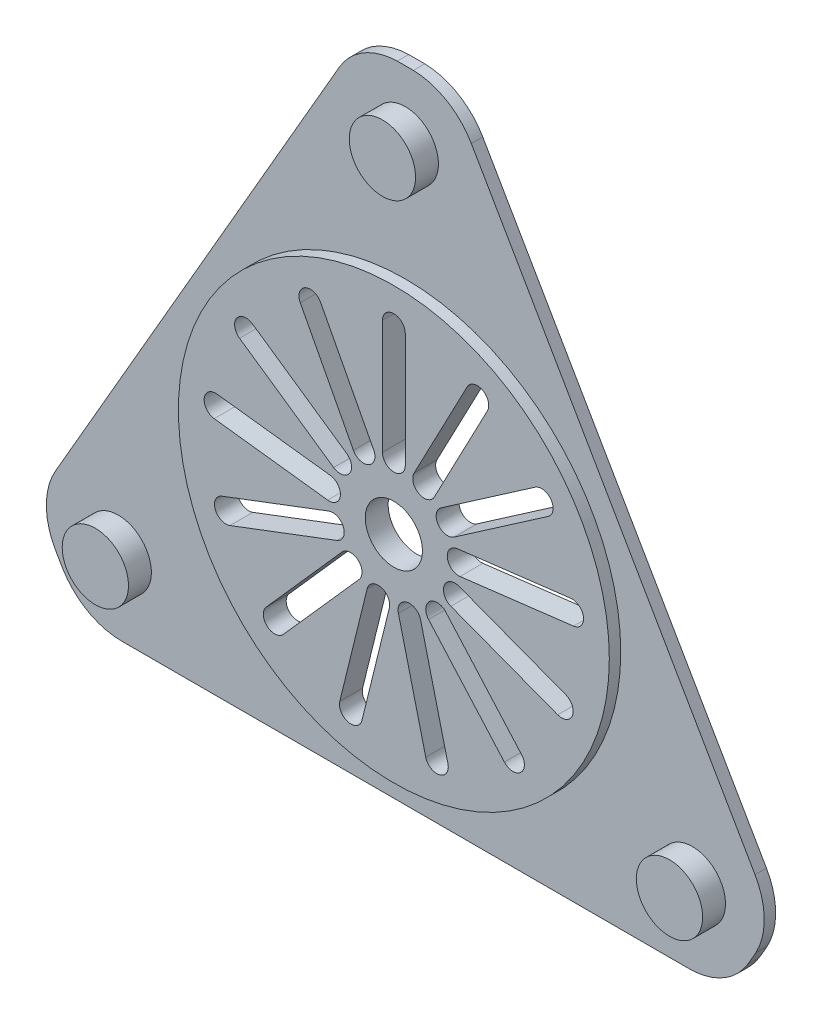
from build123d import *

# Parameters (mm, degrees)
SKETCH2_R           = 18.85
SKETCH2_R_2         = 2.5
BOSS_EXTRUDE1_DEPTH = 2
BOSS_EXTRUDE2_START = -1
SKETCH3_R           = 35
SKETCH3_R_2         = 18.85
BOSS_EXTRUDE2_DEPTH = 1
SKETCH4_R           = 2.9
BOSS_EXTRUDE3_DEPTH = 3
SKETCH6_R           = 5
BOSS_EXTRUDE4_DEPTH = 1
SKETCH7_R           = 59.131365533
CUT_EXTRUDE1_DEPTH  = 10
FILLET1_R           = 6


with BuildPart() as part:
    # Sketch2 → Boss-Extrude1 (new body)
    with BuildSketch(Plane.XY.offset(10)):
        Circle(SKETCH2_R)
        Circle(SKETCH2_R_2, mode=Mode.SUBTRACT)
        with BuildLine():
            Line((1, 15.711728477), (1, 5.711728477))
            ThreePointArc((1, 5.711728477), (0, 4.711728477), (-1, 5.711728477))
            Line((-1, 5.711728477), (-1, 15.711728477))
            ThreePointArc((-1, 15.711728477), (0, 16.711728477), (1, 15.711728477))
        make_face(mode=Mode.SUBTRACT)
        with BuildLine():
            Line((6.416148271, 14.376767826), (1.76891655, 5.522207569))
            ThreePointArc((1.76891655, 5.522207569), (2.189649404, 4.172028372), (3.539828602, 4.592761225))
            Line((3.539828602, 4.592761225), (8.187060322, 13.447321482))
            ThreePointArc((8.187060322, 13.447321482), (7.766327468, 14.797500679), (6.416148271, 14.376767826))
        make_face(mode=Mode.SUBTRACT)
        with BuildLine():
            Line((12.362434295, 9.748262924), (4.132595637, 4.067615457))
            ThreePointArc((4.132595637, 4.067615457), (3.877676517, 2.676566844), (5.26872513, 2.421647725))
            Line((5.26872513, 2.421647725), (13.498563789, 8.102295192))
            ThreePointArc((13.498563789, 8.102295192), (13.753482908, 9.493343805), (12.362434295, 9.748262924))
        make_face(mode=Mode.SUBTRACT)
        with BuildLine():
            Line((15.476635607, 2.886548466), (5.549546866, 1.681181663))
            ThreePointArc((5.549546866, 1.681181663), (4.677374672, 0.567936109), (5.790620226, -0.304236085))
            Line((5.790620226, -0.304236085), (15.717708967, 0.901130718))
            ThreePointArc((15.717708967, 0.901130718), (16.589881161, 2.014376272), (15.476635607, 2.886548466))
        make_face(mode=Mode.SUBTRACT)
        with BuildLine():
            Line((15.045326214, -4.636439459), (5.695163787, -1.090390589))
            ThreePointArc((5.695163787, -1.090390589), (4.405542658, -1.670801945), (4.985954013, -2.960423074))
            Line((4.985954013, -2.960423074), (14.33611644, -6.506471945))
            ThreePointArc((14.33611644, -6.506471945), (15.62573757, -5.926060589), (15.045326214, -4.636439459))
        make_face(mode=Mode.SUBTRACT)
        with BuildLine():
            Line((11.167313902, -11.097274979), (4.536087319, -3.612167498))
            ThreePointArc((4.536087319, -3.612167498), (3.124453913, -3.526779408), (3.039065823, -4.938412814))
            Line((3.039065823, -4.938412814), (9.670292405, -12.423520296))
            ThreePointArc((9.670292405, -12.423520296), (11.081925812, -12.508908386), (11.167313902, -11.097274979))
        make_face(mode=Mode.SUBTRACT)
        with BuildLine():
            Line((4.731004555, -15.015858538), (2.337847912, -5.306440364))
            ThreePointArc((2.337847912, -5.306440364), (1.127590431, -4.574814211), (0.395964277, -5.785071693))
            Line((0.395964277, -5.785071693), (2.78912092, -15.494489867))
            ThreePointArc((2.78912092, -15.494489867), (3.999378402, -16.22611602), (4.731004555, -15.015858538))
        make_face(mode=Mode.SUBTRACT)
        with BuildLine():
            Line((-2.78912092, -15.494489867), (-0.395964277, -5.785071693))
            ThreePointArc((-0.395964277, -5.785071693), (-1.127590431, -4.574814211), (-2.337847912, -5.306440364))
            Line((-2.337847912, -5.306440364), (-4.731004555, -15.015858538))
            ThreePointArc((-4.731004555, -15.015858538), (-3.999378402, -16.22611602), (-2.78912092, -15.494489867))
        make_face(mode=Mode.SUBTRACT)
        with BuildLine():
            Line((-9.670292405, -12.423520296), (-3.039065823, -4.938412814))
            ThreePointArc((-3.039065823, -4.938412814), (-3.124453913, -3.526779408), (-4.536087319, -3.612167498))
            Line((-4.536087319, -3.612167498), (-11.167313902, -11.097274979))
            ThreePointArc((-11.167313902, -11.097274979), (-11.081925812, -12.508908386), (-9.670292405, -12.423520296))
        make_face(mode=Mode.SUBTRACT)
        with BuildLine():
            Line((-14.33611644, -6.506471945), (-4.985954013, -2.960423074))
            ThreePointArc((-4.985954013, -2.960423074), (-4.405542658, -1.670801945), (-5.695163787, -1.090390589))
            Line((-5.695163787, -1.090390589), (-15.045326214, -4.636439459))
            ThreePointArc((-15.045326214, -4.636439459), (-15.62573757, -5.926060589), (-14.33611644, -6.506471945))
        make_face(mode=Mode.SUBTRACT)
        with BuildLine():
            Line((-15.717708967, 0.901130718), (-5.790620226, -0.304236085))
            ThreePointArc((-5.790620226, -0.304236085), (-4.677374672, 0.567936109), (-5.549546866, 1.681181663))
            Line((-5.549546866, 1.681181663), (-15.476635607, 2.886548466))
            ThreePointArc((-15.476635607, 2.886548466), (-16.589881161, 2.014376272), (-15.717708967, 0.901130718))
        make_face(mode=Mode.SUBTRACT)
        with BuildLine():
            Line((-13.498563789, 8.102295192), (-5.26872513, 2.421647725))
            ThreePointArc((-5.26872513, 2.421647725), (-3.877676517, 2.676566844), (-4.132595637, 4.067615457))
            Line((-4.132595637, 4.067615457), (-12.362434295, 9.748262924))
            ThreePointArc((-12.362434295, 9.748262924), (-13.753482908, 9.493343805), (-13.498563789, 8.102295192))
        make_face(mode=Mode.SUBTRACT)
        with BuildLine():
            Line((-8.187060322, 13.447321482), (-3.539828602, 4.592761225))
            ThreePointArc((-3.539828602, 4.592761225), (-2.189649404, 4.172028372), (-1.76891655, 5.522207569))
            Line((-1.76891655, 5.522207569), (-6.416148271, 14.376767826))
            ThreePointArc((-6.416148271, 14.376767826), (-7.766327468, 14.797500679), (-8.187060322, 13.447321482))
        make_face(mode=Mode.SUBTRACT)
    extrude(amount=-BOSS_EXTRUDE1_DEPTH)

    # Sketch3 → Boss-Extrude2 (add)
    with BuildSketch(Plane(origin=(0, 0, 8), x_dir=(-1, 0, 0), z_dir=(0, 0, -1)).offset(BOSS_EXTRUDE2_START)):
        Circle(SKETCH3_R)
        with Locations(Location((0, 0, 0), (0, 0, 180))):
            Circle(SKETCH3_R_2, mode=Mode.SUBTRACT)
    extrude(amount=BOSS_EXTRUDE2_DEPTH)

    # Sketch4 → Boss-Extrude3 (add)
    with BuildSketch(Plane(origin=(0, 0, 8), x_dir=(-1, 0, 0), z_dir=(0, 0, -1))):
        with Locations((0, 29)):
            Circle(SKETCH4_R)
        with Locations((25.11473671, -14.5)):
            Circle(SKETCH4_R)
        with Locations((-25.11473671, -14.5)):
            Circle(SKETCH4_R)
    extrude(amount=-BOSS_EXTRUDE3_DEPTH)

    # Sketch6 → Boss-Extrude4 (add)
    with BuildSketch(Plane(origin=(0, 0, 9), x_dir=(-1, 0, 0), z_dir=(0, 0, -1))):
        with Locations((0, 30)):
            Circle(SKETCH6_R)
        with Locations((25.980762114, -15)):
            Circle(SKETCH6_R)
        with Locations((-25.980762114, -15)):
            Circle(SKETCH6_R)
    extrude(amount=BOSS_EXTRUDE4_DEPTH)

    # Sketch7 → Cut-Extrude1 (cut)
    with BuildSketch(Plane(origin=(0, 0, 8), x_dir=(-1, 0, 0), z_dir=(0, 0, -1))):
        Circle(SKETCH7_R)
        Polygon((0, 42), (-36.373066959, -21), (36.373066959, -21), align=None, mode=Mode.SUBTRACT)
    extrude(amount=-CUT_EXTRUDE1_DEPTH, mode=Mode.SUBTRACT)

    # Fillet1
    fillet1_edges = [part.edges().sort_by_distance(p)[0] for p in [
        (-4.186533479, 34.748711306, 8.5),
        (-32.186533479, -13.748711306, 8.5),
        (-28, -21, 8.5),
        (28, -21, 8.5),
        (32.186533479, -13.748711306, 8.5),
        (4.186533479, 34.748711306, 8.5),
    ]]
    fillet(fillet1_edges, radius=FILLET1_R)


solid = part.part
